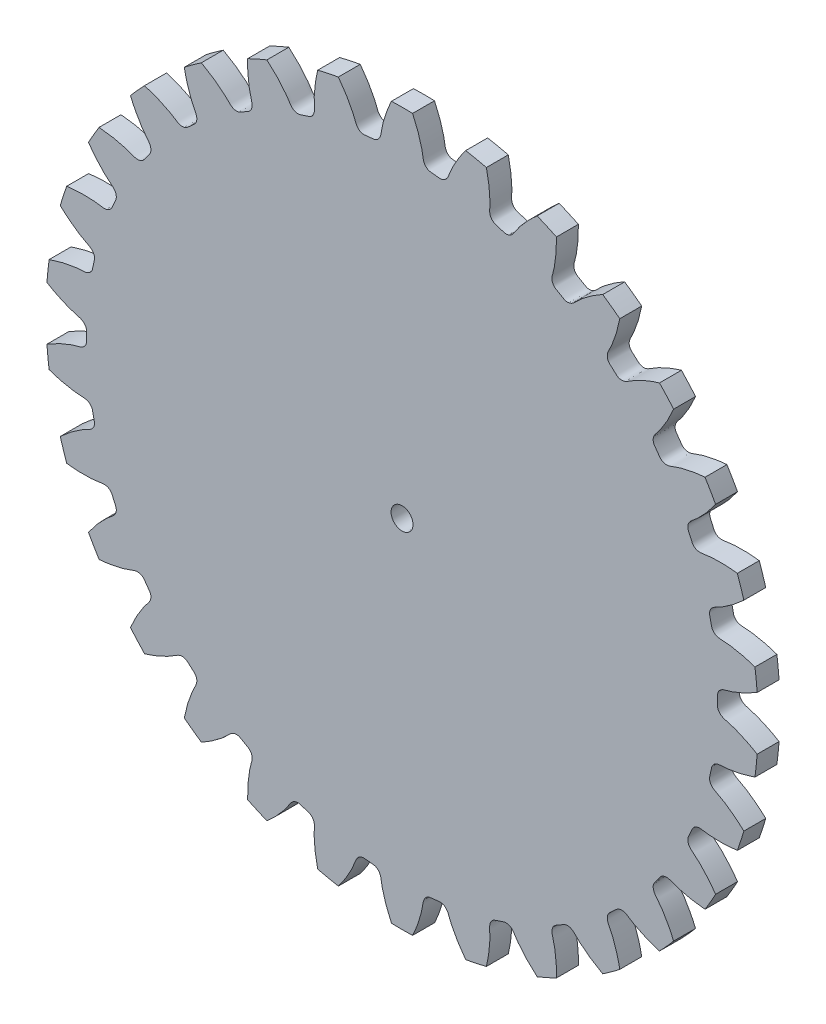
from build123d import *

# Parameters (mm, degrees)
SKETCHREVOLVEGEARTRAX1GEAR_W       = 8
SKETCHREVOLVEGEARTRAX1GEAR_H       = 129.944993333
TOOTHEXTRUDECUTGEARTRAX1GEAR_DEPTH = 4
PATTERNGEARTRAX1GEAR_COUNT         = 30


with BuildPart() as part:
    # SketchRevolveGeartrax1Gear → Geartrax1Gear (revolve)
    with BuildSketch(Plane(origin=(0, 0, 0), x_dir=(0, 0, -1), z_dir=(1, 0, 0))):
        with Locations((0, 64.972496667)):
            Rectangle(SKETCHREVOLVEGEARTRAX1GEAR_W, SKETCHREVOLVEGEARTRAX1GEAR_H)
    revolve(axis=Axis((0, 0, 0), (0, 0, -1)))

    # SketchToothGeartrax1Gear → ToothExtrudeCutGeartrax1Gear (cut, symmetric)
    with BuildSketch(Plane.XY):
        with BuildLine():
            ThreePointArc((129.893951855, 9.943239415), (130.273968, 0), (129.893951855, -9.943239415))
            add(Edge.make_bspline(
                [(129.893951855, -9.943239415), (129.023195808, -9.409257037), (127.865999799, -8.739729241), (126.41762753, -7.973090063), (125.608524708, -7.563438909), (124.82649917, -7.18515925), (124.072412054, -6.837128714), (123.347092251, -6.51820303), (122.651336098, -6.227218986), (121.98590786, -5.962991668), (121.35153574, -5.724326599), (120.748923803, -5.509981871), (120.178709387, -5.318801189), (119.641606235, -5.149265147), (119.137919181, -5.00101136), (118.457940177, -4.810580754), (117.868030022, -4.683485164), (117.38446109, -4.516922433), (117.183695518, -4.43865656), (116.982048456, -4.349319117), (116.777759856, -4.24606692), (116.568951306, -4.124827784), (116.353911285, -3.979925854), (116.131720323, -3.803566925), (115.903482569, -3.585504004), (115.674518318, -3.313432195), (115.457055123, -2.975197474), (115.273456409, -2.564278555), (115.153917884, -2.103400497), (115.103155426, -1.238882426), (115.170535137, 0), (115.103155426, 1.238882426), (115.153917884, 2.103400497), (115.273456409, 2.564278555), (115.457055123, 2.975197474), (115.674518318, 3.313432195), (115.903482569, 3.585504004), (116.131720323, 3.803566925), (116.353911285, 3.979925854), (116.568951306, 4.124827784), (116.777759856, 4.24606692), (116.982048456, 4.349319117), (117.183695518, 4.43865656), (117.38446109, 4.516922433), (117.868030022, 4.683485164), (118.457940177, 4.810580754), (119.137919181, 5.00101136), (119.641606235, 5.149265147), (120.178709387, 5.318801189), (120.748923803, 5.509981871), (121.35153574, 5.724326599), (121.98590786, 5.962991668), (122.651336098, 6.227218986), (123.347092251, 6.51820303), (124.072412054, 6.837128714), (124.82649917, 7.18515925), (125.608524708, 7.563438909), (126.41762753, 7.973090063), (127.865999799, 8.739729241), (129.023195808, 9.409257037), (129.893951855, 9.943239415)],
                knots=[0, 0, 0, 0, 0.07965202, 0.104218255, 0.127791901, 0.150372957, 0.171961423, 0.192557299, 0.212160586, 0.230771282, 0.248389389, 0.265014906, 0.280647833, 0.29528817, 0.308935917, 0.321591075, 0.35036196, 0.35588108, 0.361459251, 0.367162284, 0.373074036, 0.37930146, 0.385980133, 0.393278697, 0.401398083, 0.410556758, 0.420947396, 0.432651188, 0.44552217, 0.457824257, 0.5, 0.542175743, 0.55447783, 0.567348812, 0.579052604, 0.589443242, 0.598601917, 0.606721303, 0.614019867, 0.62069854, 0.626925964, 0.632837716, 0.638540749, 0.64411892, 0.64963804, 0.678408925, 0.691064083, 0.70471183, 0.719352167, 0.734985094, 0.751610611, 0.769228718, 0.787839414, 0.807442701, 0.828038577, 0.849627043, 0.872208099, 0.895781745, 0.92034798, 1, 1, 1, 1], degree=3))
        make_face()
    toothextrudecutgeartrax1gear = extrude(amount=TOOTHEXTRUDECUTGEARTRAX1GEAR_DEPTH, both=True, mode=Mode.SUBTRACT)

    # PatternGeartrax1Gear: ToothExtrudeCutGeartrax1Gear ×30 about axis
    patterngeartrax1gear_axis = Axis((0, 0, 4.4), (0, 0, -1))
    for i in range(1, PATTERNGEARTRAX1GEAR_COUNT):
        add(toothextrudecutgeartrax1gear.rotate(patterngeartrax1gear_axis, i * 360 / PATTERNGEARTRAX1GEAR_COUNT), mode=Mode.SUBTRACT)

    # BoreRevolveSketch → BoreRevolveCut (revolve, cut)
    with BuildSketch(Plane(origin=(0, 0, 0), x_dir=(0, 0, -1), z_dir=(1, 0, 0))):
        Polygon((-4, 0), (4, 0), (4, 4.05), (-4, 4), align=None)
    revolve(axis=Axis((0, 0, 0), (0, 0, -1)), mode=Mode.SUBTRACT)


solid = part.part
